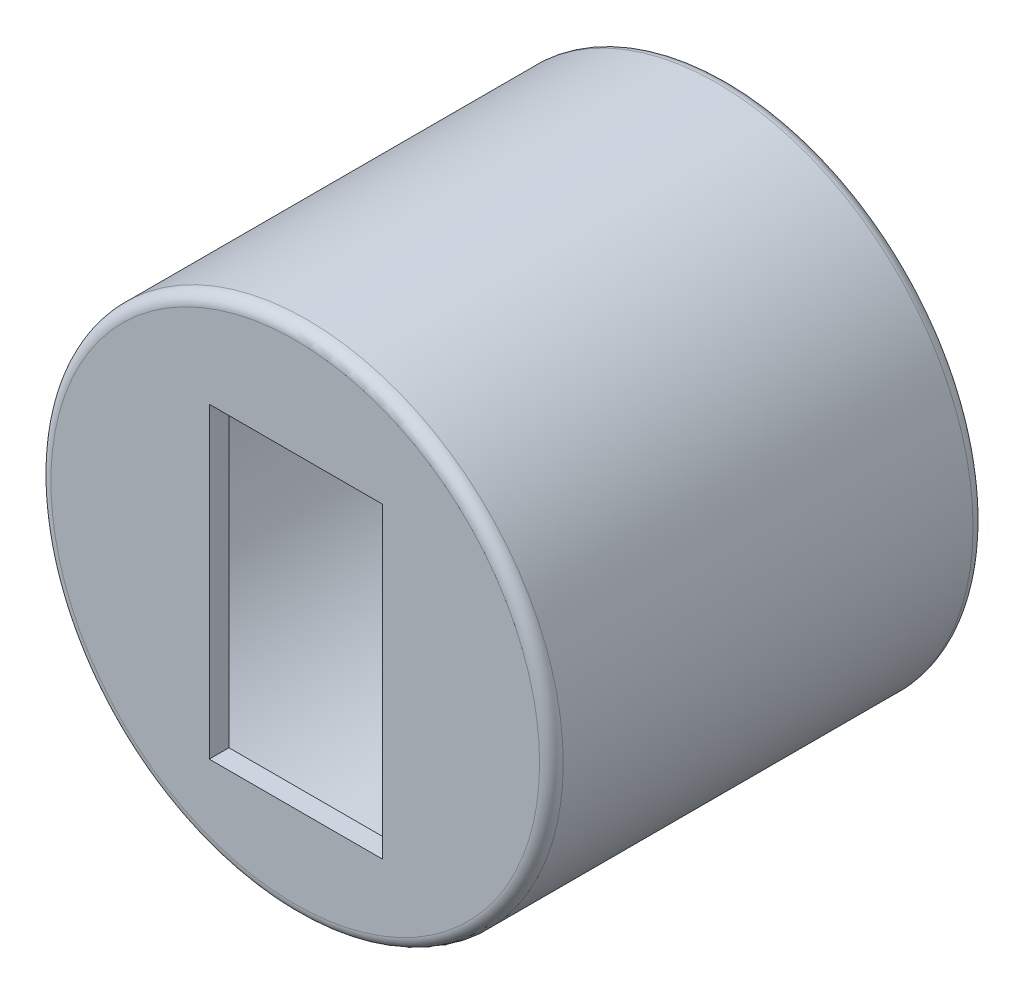
from build123d import *

# Parameters (mm, degrees)
SKETCH1_R           = 6.5
SKETCH1_R_2         = 6
BOSS_EXTRUDE1_DEPTH = 10
BOSS_EXTRUDE2_START = 0.5
SKETCH2_R           = 6.5
BOSS_EXTRUDE2_DEPTH = 0.5
SKETCH3_R           = 6.5
SKETCH3_W           = 4.4
SKETCH3_H           = 7.8
BOSS_EXTRUDE3_DEPTH = 0.5
SKETCH4_W           = 2.9
SKETCH4_H           = 3.6
CUT_EXTRUDE1_DEPTH  = 1
FILLET1_R           = 0.1
FILLET2_R           = 0.3


with BuildPart() as part:
    # Sketch1 → Boss-Extrude1 (new body)
    with BuildSketch(Plane.XY):
        Circle(SKETCH1_R)
        Circle(SKETCH1_R_2, mode=Mode.SUBTRACT)
    extrude(amount=BOSS_EXTRUDE1_DEPTH)

    # Sketch2 → Boss-Extrude2 (add)
    with BuildSketch(Plane(origin=(0, 0, 0), x_dir=(-1, 0, 0), z_dir=(0, 0, -1)).offset(BOSS_EXTRUDE2_START)):
        Circle(SKETCH2_R)
    extrude(amount=-BOSS_EXTRUDE2_DEPTH)

    # Sketch3 → Boss-Extrude3 (add)
    with BuildSketch(Plane.XY.offset(10)):
        with Locations(Location((0, 0, 0), (0, 0, 180))):
            Circle(SKETCH3_R)
        with Locations((0.018144407, -0.2)):
            Rectangle(SKETCH3_W, SKETCH3_H, mode=Mode.SUBTRACT)
    extrude(amount=BOSS_EXTRUDE3_DEPTH)

    # Sketch4 → Cut-Extrude1 (cut)
    with BuildSketch(Plane(origin=(0, 0, -0.5), x_dir=(-1, 0, 0), z_dir=(0, 0, -1))):
        Rectangle(SKETCH4_W, SKETCH4_H)
    extrude(amount=-CUT_EXTRUDE1_DEPTH, mode=Mode.SUBTRACT)

    # Fillet1
    fillet1_edges = [part.edges().sort_by_distance(p)[0] for p in [
        (-1.45, 1.8, -0.25),
        (-1.45, -1.8, -0.25),
        (1.45, -1.8, -0.25),
        (1.45, 1.8, -0.25),
    ]]
    fillet(fillet1_edges, radius=FILLET1_R)

    # Fillet2
    fillet2_edges = [part.edges().sort_by_distance(p)[0] for p in [
        (6.5, 0, -0.5),
        (6.5, 0, 10.5),
    ]]
    fillet(fillet2_edges, radius=FILLET2_R)


solid = part.part
